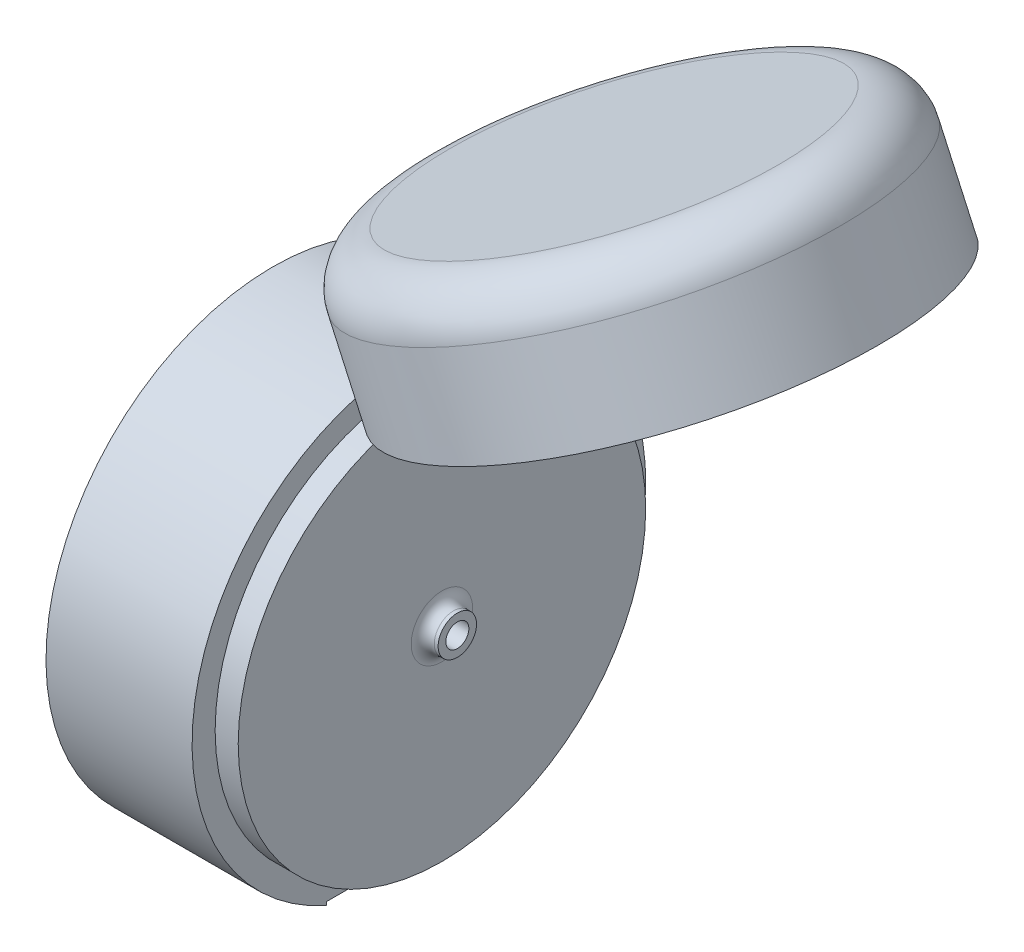
from build123d import *

# Parameters (mm, degrees)
BOTTOM_SKETCH_R                = 14.75
BOTTOM_BASE_EXTRUDE_DEPTH      = 9.5
RAISED_START                   = 9.5
SKETCH5_9_R                    = 13.25
SKETCH5_9_R_2                  = 11.75
SKETCH5_9_R_3                  = 0.75
RAISED_PLATFORM_EXTRUDE_DEPTH  = 1.5
SKETCH5_10_R                   = 11.75
HOLLOW_BASE_EXTRUDED_CUT_DEPTH = 8
NOZZLE_EXTRUDED_CUT_DEPTH      = 24.582302687
NOZZLE_EXTRUDED_CUT_DEPTH_BACK = 24.582302687
SKETCH5_11_R                   = 0.75
HINGE_REVOLVE_ANGLE            = 22
LID_SKETCH_R                   = 14.75
LID_EXTRUDE_DEPTH              = 9
LID_SKETCH_4_R                 = 13.25
LID_SKETCH_4_R_2               = 11.75
LID_LIP_EXTRUDED_CUT_DEPTH     = 1.5
LID_SKETCH_5_R                 = 11.75
LID_INNER_EXTRUDED_CUT_DEPTH   = 6
LID_FILLET_R                   = 3
OPENER_SLOT_EXTRUDED_CUT_DEPTH = 1.5
NOZZLE_START                   = 11
SKETCH5_R                      = 1.25
SKETCH5_R_2                    = 0.75
NOZZLE_EXTRUDE_DEPTH           = 1
INNER_NOZZLE_FILLET_R          = 1.25
OUTER_NOZZLE_FILLET_R          = 0.75
TIP_START                      = 6
SKETCH6_R                      = 0.75
TIP_EXTRUDE_DEPTH              = 5
TIP_FILLET_R                   = 2.5


with BuildPart() as part:
    # Bottom Sketch → Bottom Base Extrude (new body)
    with BuildSketch(Plane(origin=(0, 0, 0), x_dir=(0, 0, -1), z_dir=(1, 0, 0))):
        Circle(BOTTOM_SKETCH_R)
    extrude(amount=BOTTOM_BASE_EXTRUDE_DEPTH)

    # Sketch5<9> → Raised Platform Extrude (add)
    # profile 1 of 2: a face of its own
    with BuildSketch(Plane(origin=(0, 0, 0), x_dir=(0, 0, -1), z_dir=(1, 0, 0)).offset(RAISED_START)):
        Circle(SKETCH5_9_R)
        Circle(SKETCH5_9_R_2, mode=Mode.SUBTRACT)
    # profile 2 of 2: a face of its own
    with BuildSketch(Plane(origin=(0, 0, 0), x_dir=(0, 0, -1), z_dir=(1, 0, 0)).offset(RAISED_START)):
        Circle(SKETCH5_9_R_2)
        Circle(SKETCH5_9_R_3, mode=Mode.SUBTRACT)
    extrude(amount=RAISED_PLATFORM_EXTRUDE_DEPTH)

    # Sketch5<10> → Hollow Base Extruded Cut (cut)
    with BuildSketch(Plane(origin=(0, 0, 0), x_dir=(0, 0, -1), z_dir=(1, 0, 0))):
        Circle(SKETCH5_10_R)
    extrude(amount=HOLLOW_BASE_EXTRUDED_CUT_DEPTH, mode=Mode.SUBTRACT)

    # Sketch5<11> → Nozzle Extruded Cut (cut, two sides: drawn at the far end of the back side and taken through both)
    with BuildSketch(Plane(origin=(0, 0, 0), x_dir=(0, 0, -1), z_dir=(1, 0, 0)).offset(-NOZZLE_EXTRUDED_CUT_DEPTH_BACK)):
        Circle(SKETCH5_11_R)
    extrude(amount=NOZZLE_EXTRUDED_CUT_DEPTH + NOZZLE_EXTRUDED_CUT_DEPTH_BACK, mode=Mode.SUBTRACT)

    # Hinge Sketch → Hinge Revolve (revolve, symmetric)
    with BuildSketch(Plane.XY) as hinge_revolve_sk:
        with BuildLine():
            Line((12.269465839, 19.594637607), (9.5, 18.303214477))
            ThreePointArc((9.5, 18.303214477), (8.103339463, 16.799596896), (8, 14.75))
            Line((8, 14.75), (9.5, 14.75))
            Line((9.5, 14.75), (9.5, 16.25))
            ThreePointArc((9.5, 16.25), (9.780754427, 16.667120789), (10.183578371, 16.968028868))
            Line((10.183578371, 16.968028868), (12.902931841, 18.234960871))
            Line((12.902931841, 18.234960871), (12.269465839, 19.594637607))
        make_face()
    revolve(axis=Axis((0, 0, 0), (1, 0, 0)), revolution_arc=HINGE_REVOLVE_ANGLE / 2)
    revolve(hinge_revolve_sk.sketch, axis=Axis((0, 0, 0), (-1, 0, 0)), revolution_arc=HINGE_REVOLVE_ANGLE / 2)

    # Lid Sketch → Lid Extrude (add)
    with BuildSketch(Plane(origin=(-4.538332603, 9.923436614, 0), x_dir=(-0.9064511568417262, -0.4145516315149191, 0.08058067428741963), z_dir=(-0.41590411426046653, 0.9094084713379443, 0))):
        with Locations(Location((-33.403459346, 2.700454914, 0), (0, 0, 341.733897082))):
            Circle(LID_SKETCH_R)
    extrude(amount=LID_EXTRUDE_DEPTH)

    # Lid Sketch<4> → Lid Lip Extruded Cut (cut)
    with BuildSketch(Plane(origin=(-4.538332603, 9.923436614, 0), x_dir=(-0.9064511568417262, -0.4145516315149191, 0.08058067428741963), z_dir=(-0.41590411426046653, 0.9094084713379443, 0))):
        with Locations(Location((-33.403459346, 2.700454914, 0), (0, 0, 355.378056318))):
            Circle(LID_SKETCH_4_R)
        with Locations(Location((-33.403459346, 2.700454914, 0), (0, 0, 355.378056318))):
            Circle(LID_SKETCH_4_R_2, mode=Mode.SUBTRACT)
    extrude(amount=LID_LIP_EXTRUDED_CUT_DEPTH, mode=Mode.SUBTRACT)

    # Lid Sketch<5> → Lid Inner Extruded Cut (cut)
    with BuildSketch(Plane(origin=(-4.538332603, 9.923436614, 0), x_dir=(-0.9064511568417262, -0.4145516315149191, 0.08058067428741963), z_dir=(-0.41590411426046653, 0.9094084713379443, 0))):
        with Locations(Location((-33.403459346, 2.700454914, 0), (0, 0, 355.378056318))):
            Circle(LID_SKETCH_5_R)
    extrude(amount=LID_INNER_EXTRUDED_CUT_DEPTH, mode=Mode.SUBTRACT)

    # Lid Fillet
    lid_fillet_edges = [part.edges().sort_by_distance(p)[0] for p in [
        (35.230257369, 38.007538524, 3.479394565),
        (34.128287972, 34.204721952, 0),
    ]]
    fillet(lid_fillet_edges, radius=LID_FILLET_R)

    # Opener Slot Sketch → Opener Slot Extruded Cut (cut)
    with BuildSketch(Plane(origin=(0, -14.75, 0), x_dir=(-1, 0, 0), z_dir=(0, -1, 0))):
        with BuildLine():
            Line((-4.246036774, 3.654181831), (-9.5, 5.99339697))
            Line((-9.5, 5.99339697), (-9.5, 0))
            Line((-9.5, 0), (-2, 0))
            Line((-2, 0), (-2, 1))
            ThreePointArc((-2, 1), (-2.819546336, 2.583896752), (-4.246036774, 3.654181831))
        make_face()
        with BuildLine():
            Line((-2, 0), (-9.5, 0))
            Line((-9.5, 0), (-9.5, -5.99339697))
            Line((-9.5, -5.99339697), (-4.246036774, -3.654181831))
            ThreePointArc((-4.246036774, -3.654181831), (-2.819546336, -2.583896752), (-2, -1))
            Line((-2, -1), (-2, 0))
        make_face()
    extrude(amount=-OPENER_SLOT_EXTRUDED_CUT_DEPTH, mode=Mode.SUBTRACT)

    # Sketch5 → Nozzle Extrude (add)
    with BuildSketch(Plane(origin=(0, 0, 0), x_dir=(0, 0, -1), z_dir=(1, 0, 0)).offset(NOZZLE_START)):
        Circle(SKETCH5_R)
        Circle(SKETCH5_R_2, mode=Mode.SUBTRACT)
    extrude(amount=NOZZLE_EXTRUDE_DEPTH)

    # Inner Nozzle Fillet
    inner_nozzle_fillet_edges = [part.edges().sort_by_distance(p)[0] for p in [
        (8, 0, 0.75),
    ]]
    fillet(inner_nozzle_fillet_edges, radius=INNER_NOZZLE_FILLET_R)

    # Outer Nozzle Fillet
    outer_nozzle_fillet_edges = [part.edges().sort_by_distance(p)[0] for p in [
        (11, 0, 1.25),
    ]]
    fillet(outer_nozzle_fillet_edges, radius=OUTER_NOZZLE_FILLET_R)

    # Sketch6 → Tip Extrude (add)
    with BuildSketch(Plane(origin=(-4.538332603, 9.923436614, 0), x_dir=(-0.9064511568417262, -0.4145516315149191, 0.08058067428741963), z_dir=(-0.41590411426046653, 0.9094084713379443, 0)).offset(TIP_START)):
        with Locations(Location((-33.403459346, 2.700454914, 0), (0, 0, 355.378056318))):
            Circle(SKETCH6_R)
    extrude(amount=-TIP_EXTRUDE_DEPTH)

    # Tip Fillet
    tip_fillet_edges = [part.edges().sort_by_distance(p)[0] for p in [
        (24.124794787, 29.629776695, 0),
    ]]
    fillet(tip_fillet_edges, radius=TIP_FILLET_R)


solid = part.part
